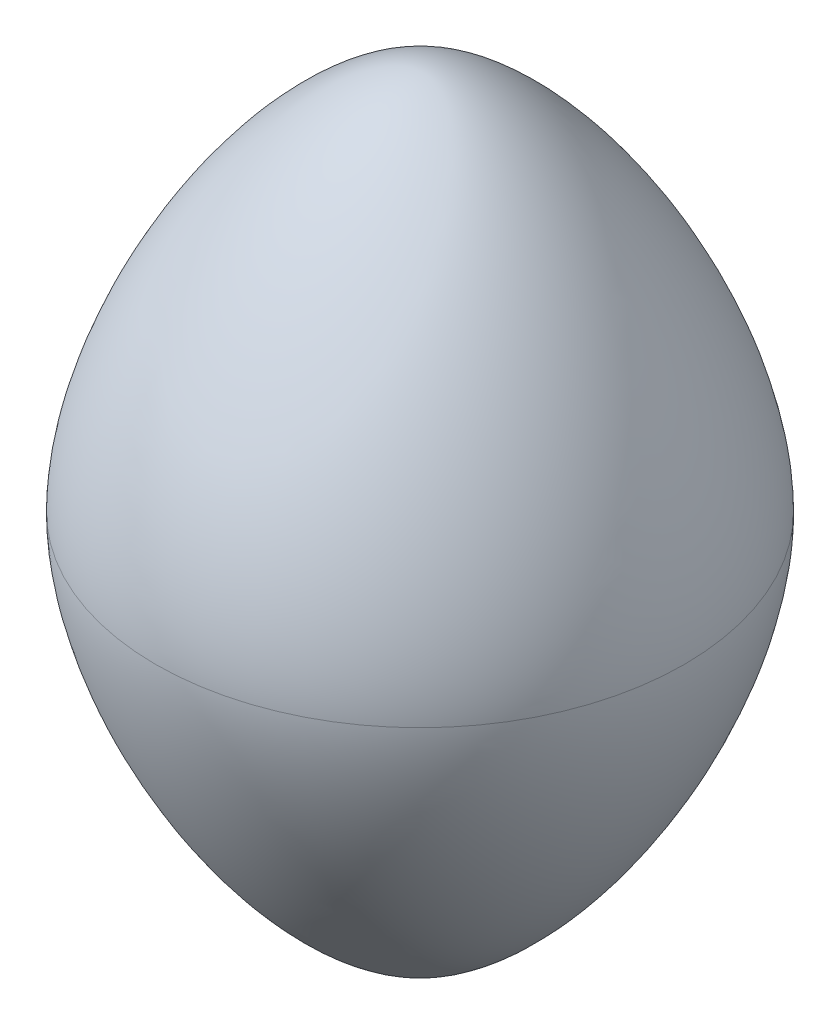
from build123d import *


with BuildPart() as part:
    # Sketch1 → Revolve1 (revolve)
    with BuildSketch(Plane.XY):
        with BuildLine():
            Line((0, 31), (0, -31))
            add(Edge.make_bspline(
                [(0, -31), (21.5, -31), (21.5, 0)],
                knots=[0, 0, 0, 1, 1, 1], degree=2, weights=[1, 0.428571429, 1]))
            add(Edge.make_bspline(
                [(0, 31), (21.5, 31), (21.5, 0)],
                knots=[0, 0, 0, 1, 1, 1], degree=2, weights=[1, 0.428571429, 1]))
        make_face()
    revolve(axis=Axis((0, 31, 0), (0, -1, 0)))


solid = part.part
